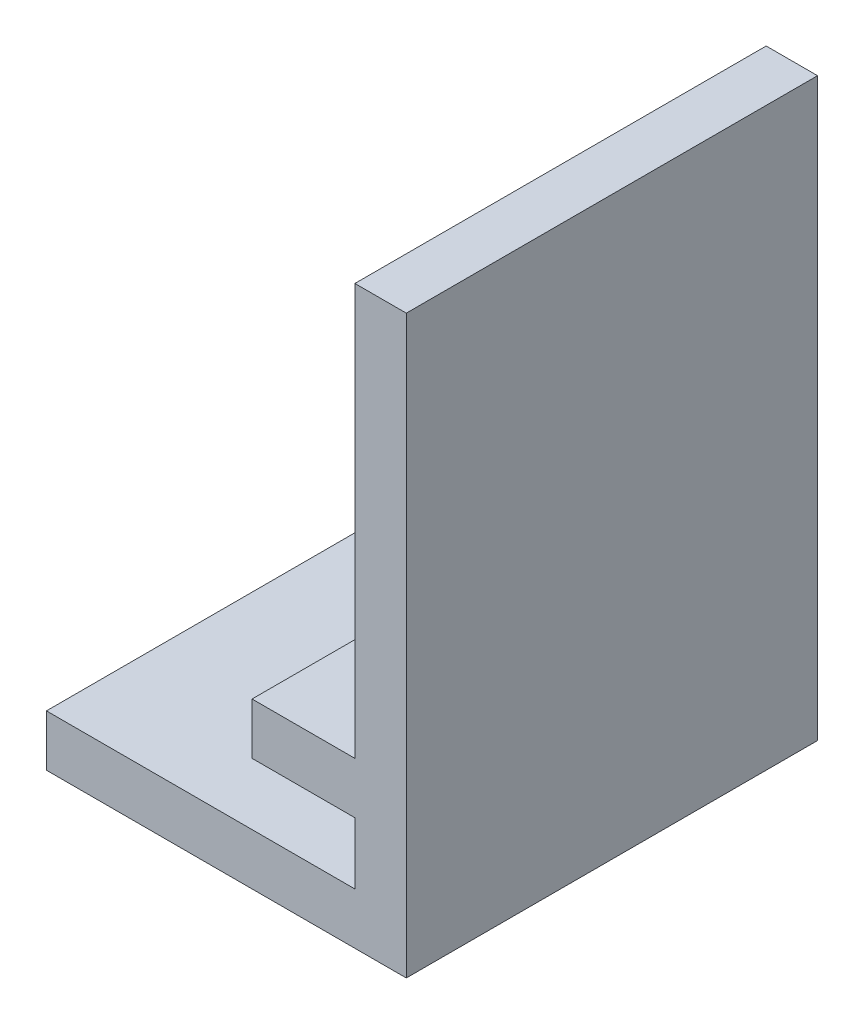
from build123d import *

# Parameters (mm, degrees)
BOSS_EXTRUDE1_DEPTH = 25.4


with BuildPart() as part:
    # Sketch1 → Boss-Extrude1 (new body)
    with BuildSketch(Plane.XY):
        Polygon((0, 0), (0, 35.56), (-3.175, 35.56), (-3.175, 10.16), (-9.525, 10.16), (-9.525, 6.985), (-3.175, 6.985), (-3.175, 3.175), (-22.225, 3.175), (-22.225, 0), align=None)
    extrude(amount=BOSS_EXTRUDE1_DEPTH)


solid = part.part
